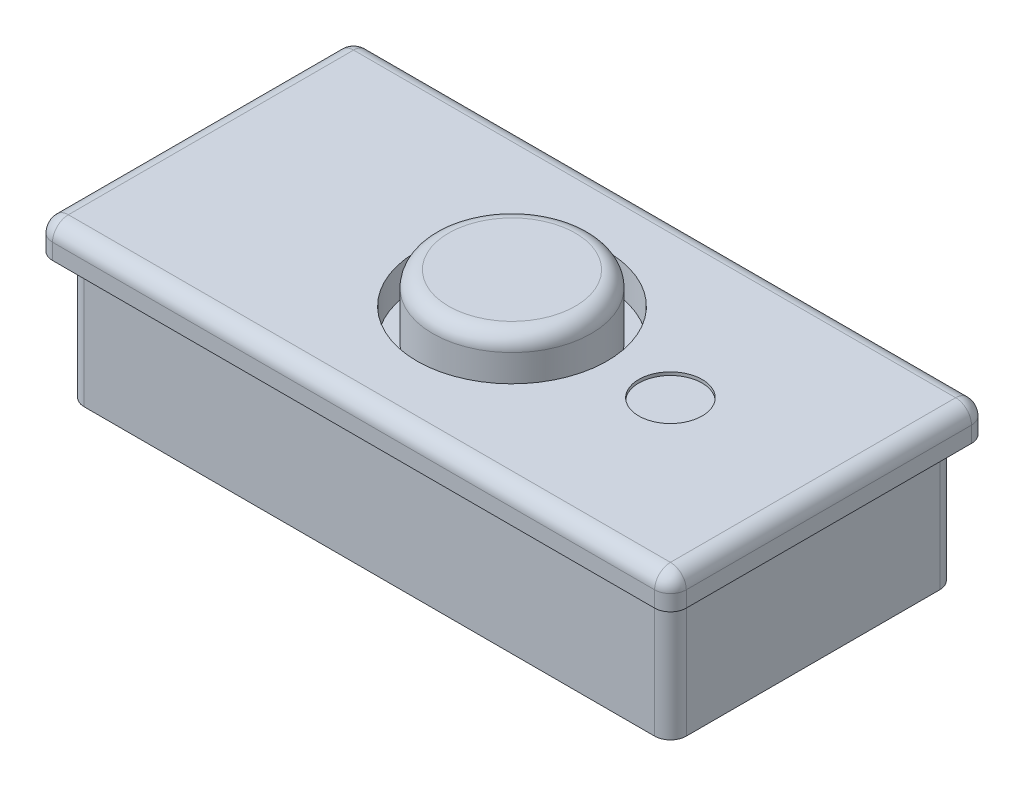
from build123d import *

# Parameters (mm, degrees)
SKETCH1_R           = 6
BOSS_EXTRUDE1_DEPTH = 2
BOSS_EXTRUDE2_DEPTH = 8
SKETCH3_R           = 5
BOSS_EXTRUDE3_DEPTH = 4
SKETCH4_R           = 2
CUT_EXTRUDE1_DEPTH  = 0.2
FILLET1_R           = 1


with BuildPart() as part:
    # Sketch1 → Boss-Extrude1 (new body)
    with BuildSketch(Plane(origin=(0, 0, 0), x_dir=(1, 0, 0), z_dir=(0, 1, 0))):
        with BuildLine():
            Line((1, 0), (39, 0))
            ThreePointArc((39, 0), (39.707106781, 0.292893219), (40, 1))
            Line((40, 1), (40, 19))
            ThreePointArc((40, 19), (39.707106781, 19.707106781), (39, 20))
            Line((39, 20), (1, 20))
            ThreePointArc((1, 20), (0.292893219, 19.707106781), (0, 19))
            Line((0, 19), (0, 1))
            ThreePointArc((0, 1), (0.292893219, 0.292893219), (1, 0))
        make_face()
        with Locations(Location((20, 10, 0), (0, 0, 270))):
            Circle(SKETCH1_R, mode=Mode.SUBTRACT)
    extrude(amount=BOSS_EXTRUDE1_DEPTH)

    # Sketch2 → Boss-Extrude2 (add)
    with BuildSketch(Plane(origin=(0, 0, 0), x_dir=(1, 0, 0), z_dir=(0, 1, 0))):
        with BuildLine():
            Line((2, 1), (38, 1))
            ThreePointArc((38, 1), (38.707106781, 1.292893219), (39, 2))
            Line((39, 2), (39, 18))
            ThreePointArc((39, 18), (38.707106781, 18.707106781), (38, 19))
            Line((38, 19), (2, 19))
            ThreePointArc((2, 19), (1.292893219, 18.707106781), (1, 18))
            Line((1, 18), (1, 2))
            ThreePointArc((1, 2), (1.292893219, 1.292893219), (2, 1))
        make_face()
    extrude(amount=-BOSS_EXTRUDE2_DEPTH)

    # Sketch3 → Boss-Extrude3 (add)
    with BuildSketch(Plane(origin=(0, 0, 0), x_dir=(1, 0, 0), z_dir=(0, 1, 0))):
        with Locations(Location((20, 10, 0), (0, 0, 270))):
            Circle(SKETCH3_R)
    extrude(amount=BOSS_EXTRUDE3_DEPTH)

    # Sketch4 → Cut-Extrude1 (cut)
    with BuildSketch(Plane(origin=(0, 2, 0), x_dir=(1, 0, 0), z_dir=(0, 1, 0))):
        with Locations(Location((30, 10, 0), (0, 0, 270))):
            Circle(SKETCH4_R)
    extrude(amount=-CUT_EXTRUDE1_DEPTH, mode=Mode.SUBTRACT)

    # Fillet1
    fillet1_edges = [part.edges().sort_by_distance(p)[0] for p in [
        (39.707106781, 2, -0.292893219),
        (40, 2, -10),
        (39.707106781, 2, -19.707106781),
        (20, 2, -20),
        (0.292893219, 2, -19.707106781),
        (0, 2, -10),
        (0.292893219, 2, -0.292893219),
        (20, 4, -15),
        (20, 2, 0),
    ]]
    fillet(fillet1_edges, radius=FILLET1_R)


solid = part.part
